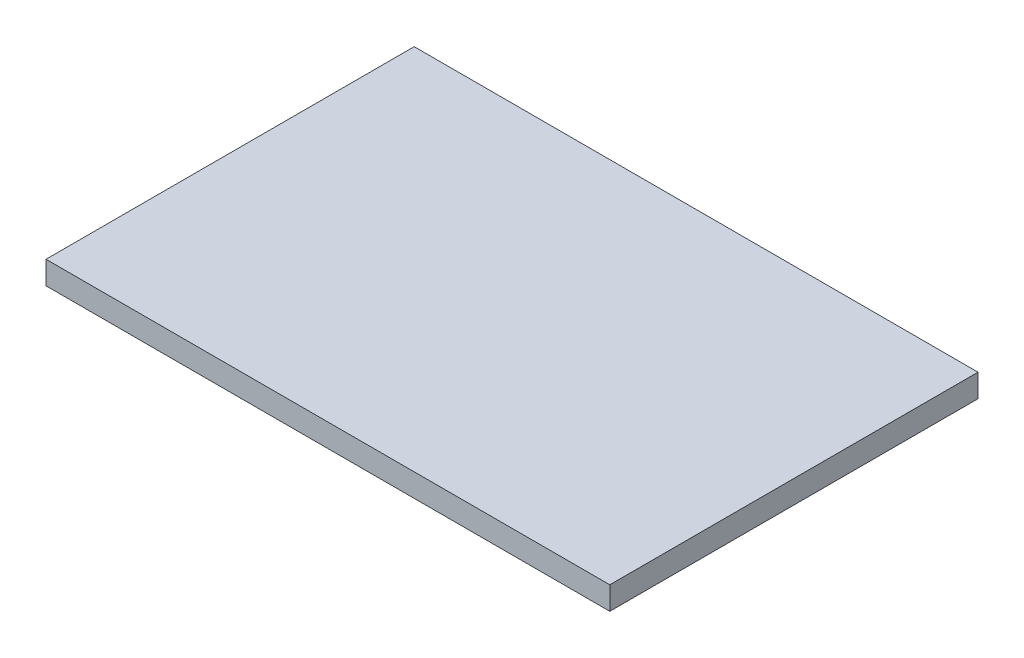
from build123d import *

# Parameters (mm, degrees)
SKETCH1_W             = 24.5
SKETCH1_H             = 16
BOSS_EXTRUDE1_DEPTH   = 1
BODY_MOVE_COPY1_ANGLE = 90


with BuildPart() as part:
    # Sketch1 → Boss-Extrude1 (new body)
    with BuildSketch(Plane.XY):
        with Locations((55.438888889, 8.105555556)):
            Rectangle(SKETCH1_W, SKETCH1_H)
    extrude(amount=BOSS_EXTRUDE1_DEPTH)


with BuildPart() as part_1:
    # Body-Move/Copy1: moved
    add(part.part.rotate(Axis((0, 8.105555556, 0.25), (1, 0, 0)), BODY_MOVE_COPY1_ANGLE))


solid = part_1.part
